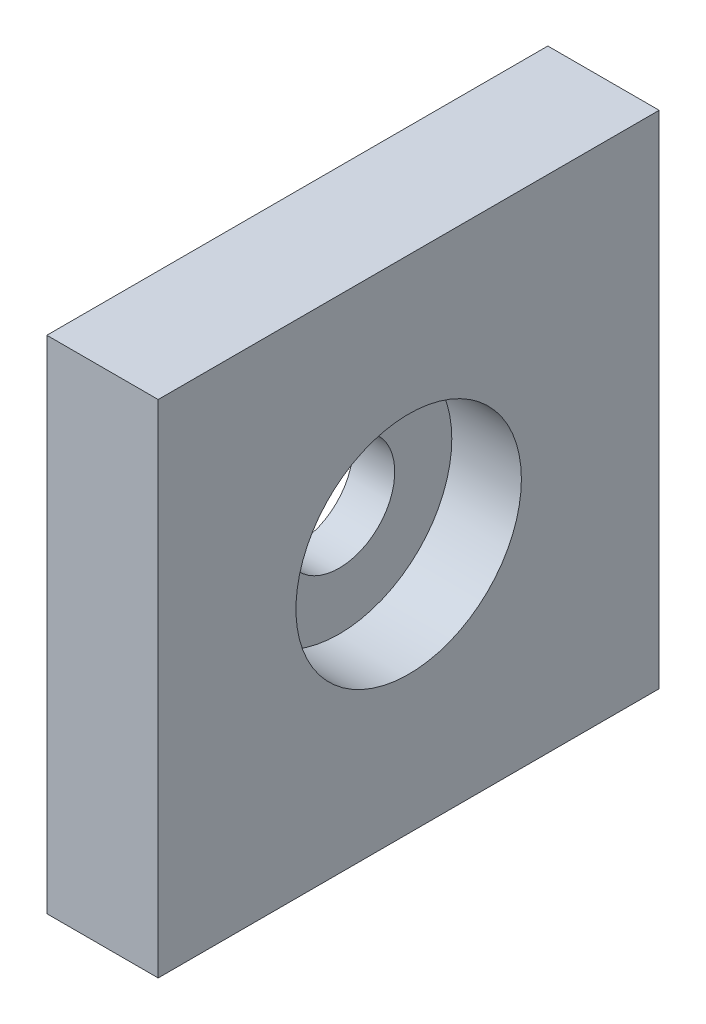
from build123d import *

# Parameters (mm, degrees)
ESQUISSE1_W             = 8
ESQUISSE1_H             = 36
BOSS_EXTRU_3_DEPTH      = 36
ESQUISSE9_R             = 8.1
ENL_V_MAT_EXTRU_1_DEPTH = 10
BOSS_EXTRU_4_START      = -3
ESQUISSE10_R            = 8.1
ESQUISSE10_R_2          = 4
BOSS_EXTRU_4_DEPTH      = 3
ESQUISSE13_R            = 2
ENL_V_MAT_EXTRU_2_DEPTH = 15


with BuildPart() as part:
    # Esquisse1 → Boss.-Extru.3 (new body)
    with BuildSketch(Plane(origin=(0, 0, 0), x_dir=(1, 0, 0), z_dir=(0, 1, 0))):
        with Locations((4, 18)):
            Rectangle(ESQUISSE1_W, ESQUISSE1_H)
    extrude(amount=BOSS_EXTRU_3_DEPTH)

    # Esquisse9 → Enlèv. mat.-Extru.1 (cut)
    with BuildSketch(Plane(origin=(8, 0, 0), x_dir=(0, 0, -1), z_dir=(1, 0, 0))):
        with Locations((18, 18)):
            Circle(ESQUISSE9_R)
    extrude(amount=-ENL_V_MAT_EXTRU_1_DEPTH, mode=Mode.SUBTRACT)

    # Esquisse10 → Boss.-Extru.4 (add)
    with BuildSketch(Plane.ZY.offset(BOSS_EXTRU_4_START)):
        with Locations((-18, 18)):
            Circle(ESQUISSE10_R)
        with Locations((-18, 18)):
            Circle(ESQUISSE10_R_2, mode=Mode.SUBTRACT)
    extrude(amount=BOSS_EXTRU_4_DEPTH)

    # Esquisse13 → Enlèv. mat.-Extru.2 (cut)
    with BuildSketch(Plane.XZ):
        with Locations((4, -4)):
            Circle(ESQUISSE13_R)
        with Locations((4, -32)):
            Circle(ESQUISSE13_R)
    extrude(amount=-ENL_V_MAT_EXTRU_2_DEPTH, mode=Mode.SUBTRACT)


solid = part.part
